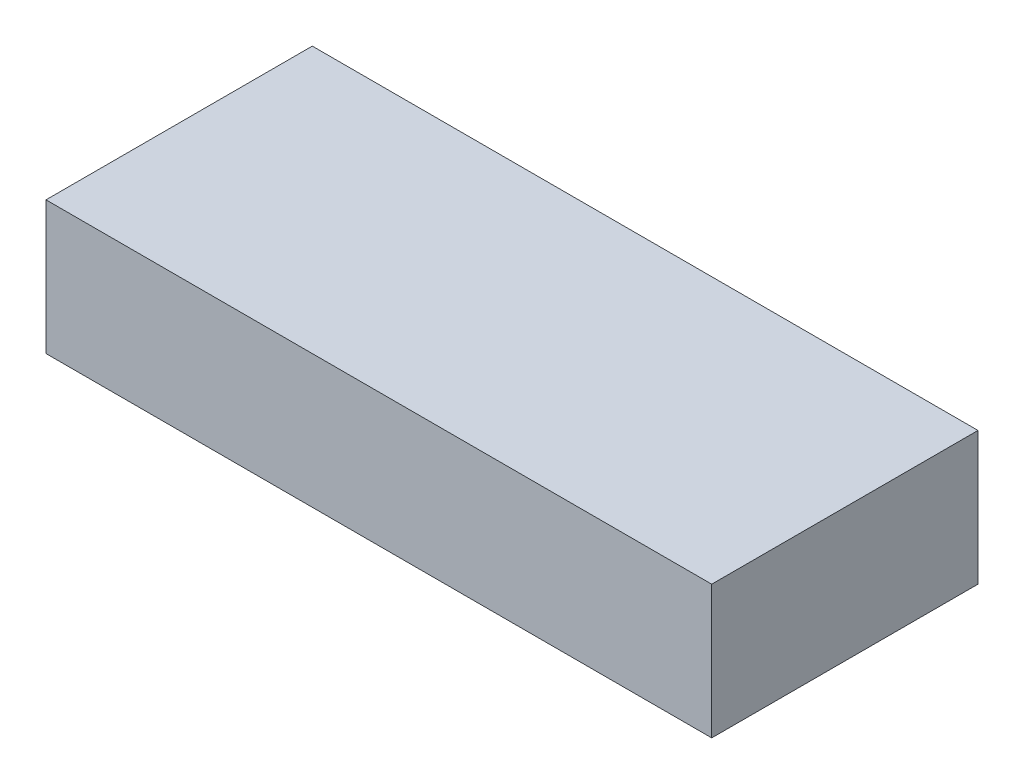
from build123d import *

# Parameters (mm, degrees)
SKETCH_1_W      = 1000
SKETCH_1_H      = 400
EXTRUDE_1_DEPTH = 200


with BuildPart() as part:
    # 草图1 → 凸台-拉伸1 (new body)
    with BuildSketch(Plane(origin=(0, 0, 0), x_dir=(1, 0, 0), z_dir=(0, 1, 0))):
        Rectangle(SKETCH_1_W, SKETCH_1_H)
    extrude(amount=EXTRUDE_1_DEPTH)


solid = part.part
